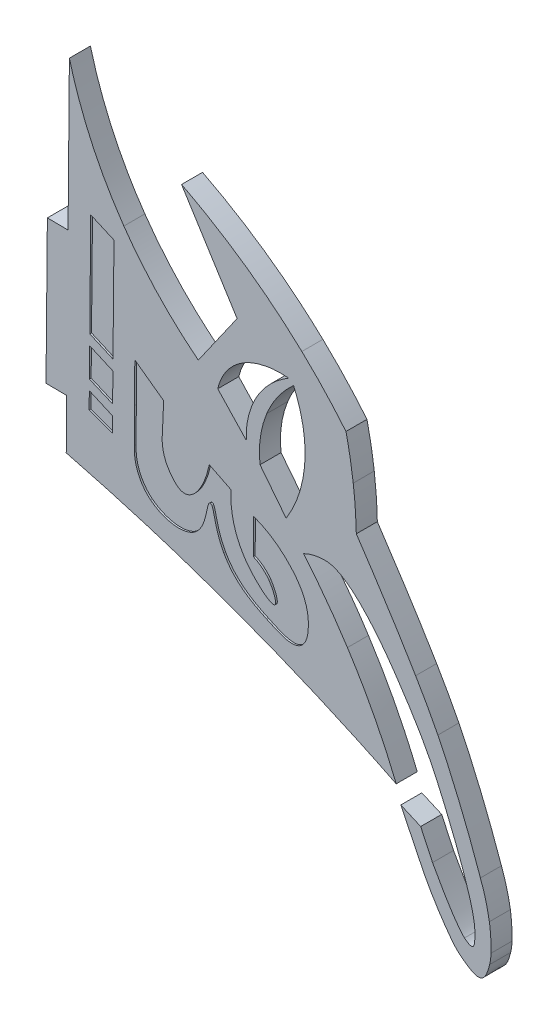
from build123d import *

# Parameters (mm, degrees)
BOSS_EXTRUDE1_DEPTH = 5.5
BOSS_EXTRUDE2_DEPTH = 6


with BuildPart() as part:
    # Model → Boss-Extrude1 (new body)
    with BuildSketch(Plane.XY):
        with BuildLine():
            add(Edge.make_bspline(
                [(88.787919, 92.364853), (92.085001, 87.464066), (99.347181, 76.543381), (105.730028, 65.744779)],
                knots=[0, 0, 0, 0, 1, 1, 1, 1], degree=3))
            add(Edge.make_bspline(
                [(87.907929, 104.458855), (88.450468, 100.119074), (88.710769, 96.06747), (88.787919, 92.364853)],
                knots=[0, 0, 0, 0, 1, 1, 1, 1], degree=3))
            add(Edge.make_bspline(
                [(85.832054, 116.197901), (86.649316, 112.63593), (87.376383, 108.710682), (87.907929, 104.458855)],
                knots=[0, 0, 0, 0, 1, 1, 1, 1], degree=3))
            add(Edge.make_bspline(
                [(73.238416, 129.684142), (78.121708, 125.092275), (82.287408, 120.530069), (85.832054, 116.197901)],
                knots=[0, 0, 0, 0, 1, 1, 1, 1], degree=3))
            add(Edge.make_bspline(
                [(38.881508, 153.813175), (49.049944, 148.582449), (61.31426, 140.896641), (73.238416, 129.684142)],
                knots=[0, 0, 0, 0, 1, 1, 1, 1], degree=3))
            add(Edge.make_bspline(
                [(54.743478, 128.576658), (49.456148, 136.988827), (44.168838, 145.400996), (38.881508, 153.813175)],
                knots=[0, 0, 0, 0, 1, 1, 1, 1], degree=3))
            add(Edge.make_bspline(
                [(43.662842, 112.749937), (47.356387, 118.025508), (51.049932, 123.301088), (54.743478, 128.576658)],
                knots=[0, 0, 0, 0, 1, 1, 1, 1], degree=3))
            add(Edge.make_bspline(
                [(22.409038, 135.290535), (29.67791, 124.862638), (37.578419, 117.550945), (43.662842, 112.749937)],
                knots=[0, 0, 0, 0, 1, 1, 1, 1], degree=3))
            add(Edge.make_bspline(
                [(6.847505, 169.039429), (9.040058, 160.67416), (13.381263, 148.241753), (22.409038, 135.290535)],
                knots=[0, 0, 0, 0, 1, 1, 1, 1], degree=3))
            add(Edge.make_bspline(
                [(6.472414, 126.333285), (6.597437, 140.568663), (6.722481, 154.804041), (6.847505, 169.039429)],
                knots=[0, 0, 0, 0, 1, 1, 1, 1], degree=3))
            add(Edge.make_bspline(
                [(0.560232, 126.38901), (2.530956, 126.370435), (4.50169, 126.35186), (6.472414, 126.333285)],
                knots=[0, 0, 0, 0, 1, 1, 1, 1], degree=3))
            add(Edge.make_bspline(
                [(0.173439, 85.282952), (0.302363, 98.984971), (0.431298, 112.686991), (0.560232, 126.38901)],
                knots=[0, 0, 0, 0, 1, 1, 1, 1], degree=3))
            add(Edge.make_bspline(
                [(6.08562, 85.227217), (4.114897, 85.245792), (2.144163, 85.264377), (0.173439, 85.282952)],
                knots=[0, 0, 0, 0, 1, 1, 1, 1], degree=3))
            add(Edge.make_bspline(
                [(5.9514, 70.962498), (5.996143, 75.717397), (6.040877, 80.472318), (6.08562, 85.227217)],
                knots=[0, 0, 0, 0, 1, 1, 1, 1], degree=3))
            add(Edge.make_bspline(
                [(42.967903, 60.018851), (30.04711, 64.421466), (17.657862, 68.016476), (5.9514, 70.962498)],
                knots=[0, 0, 0, 0, 1, 1, 1, 1], degree=3))
            add(Edge.make_bspline(
                [(100.185148, 36.223682), (83.509806, 44.479115), (64.411398, 52.712224), (42.967903, 60.018851)],
                knots=[0, 0, 0, 0, 1, 1, 1, 1], degree=3))
            add(Edge.make_bspline(
                [(86.258715, 62.967924), (92.48947, 53.320118), (96.953071, 44.179627), (100.185148, 36.223682)],
                knots=[0, 0, 0, 0, 1, 1, 1, 1], degree=3))
            add(Edge.make_bspline(
                [(73.697821, 79.933072), (77.813614, 75.051652), (82.100468, 69.406599), (86.258715, 62.967924)],
                knots=[0, 0, 0, 0, 1, 1, 1, 1], degree=3))
            add(Edge.make_bspline(
                [(80.203793, 81.336684), (77.512305, 81.454112), (75.242726, 80.660449), (73.697821, 79.933072)],
                knots=[0, 0, 0, 0, 1, 1, 1, 1], degree=3))
            add(Edge.make_bspline(
                [(99.746272, 63.512213), (87.992335, 80.587968), (82.025433, 81.257217), (80.203793, 81.336684)],
                knots=[0, 0, 0, 0, 1, 1, 1, 1], degree=3))
            add(Edge.make_bspline(
                [(109.917838, 46.825246), (107.601257, 51.377877), (104.564845, 56.511948), (99.746272, 63.512213)],
                knots=[0, 0, 0, 0, 1, 1, 1, 1], degree=3))
            add(Edge.make_bspline(
                [(114.062823, 37.740921), (112.488819, 41.413806), (110.950371, 44.796079), (109.917838, 46.825246)],
                knots=[0, 0, 0, 0, 1, 1, 1, 1], degree=3))
            add(Edge.make_bspline(
                [(117.05444, 30.38759), (115.694413, 33.903154), (114.559069, 36.582932), (114.062823, 37.740921)],
                knots=[0, 0, 0, 0, 1, 1, 1, 1], degree=3))
            add(Edge.make_bspline(
                [(119.666418, 23.293093), (118.682468, 26.185086), (117.846872, 28.339191), (117.05444, 30.38759)],
                knots=[0, 0, 0, 0, 1, 1, 1, 1], degree=3))
            add(Edge.make_bspline(
                [(121.247033, 18.357223), (120.767612, 20.046967), (120.289001, 21.463236), (119.666418, 23.293093)],
                knots=[0, 0, 0, 0, 1, 1, 1, 1], degree=3))
            add(Edge.make_bspline(
                [(121.967223, 15.625716), (121.680223, 16.800831), (121.422744, 17.737894), (121.247033, 18.357223)],
                knots=[0, 0, 0, 0, 1, 1, 1, 1], degree=3))
            add(Edge.make_bspline(
                [(122.536624, 7.982564), (123.008542, 11.10405), (122.224856, 14.570844), (121.967223, 15.625716)],
                knots=[0, 0, 0, 0, 1, 1, 1, 1], degree=3))
            add(Edge.make_bspline(
                [(121.93802, 6.872522), (122.374484, 7.058271), (122.485147, 7.642011), (122.536624, 7.982564)],
                knots=[0, 0, 0, 0, 1, 1, 1, 1], degree=3))
            add(Edge.make_bspline(
                [(119.69481, 7.870303), (120.141857, 7.494409), (121.236522, 6.574), (121.93802, 6.872522)],
                knots=[0, 0, 0, 0, 1, 1, 1, 1], degree=3))
            add(Edge.make_bspline(
                [(110.551763, 21.934408), (112.124156, 19.051097), (117.115032, 10.039459), (119.69481, 7.870303)],
                knots=[0, 0, 0, 0, 1, 1, 1, 1], degree=3))
            add(Edge.make_bspline(
                [(107.174688, 29.168822), (108.692678, 25.986783), (109.856958, 23.457185), (110.551763, 21.934408)],
                knots=[0, 0, 0, 0, 1, 1, 1, 1], degree=3))
            add(Edge.make_bspline(
                [(101.500431, 31.66388), (103.39185, 30.832204), (105.283269, 30.000518), (107.174688, 29.168822)],
                knots=[0, 0, 0, 0, 1, 1, 1, 1], degree=3))
            add(Edge.make_bspline(
                [(108.130123, 18.050738), (105.148802, 24.10867), (102.841551, 28.879433), (101.500431, 31.66388)],
                knots=[0, 0, 0, 0, 1, 1, 1, 1], degree=3))
            add(Edge.make_bspline(
                [(116.290954, 5.216691), (111.138974, 11.97007), (108.130123, 18.050728), (108.130123, 18.050738)],
                knots=[0, 0, 0, 0, 1, 1, 1, 1], degree=3))
            add(Edge.make_bspline(
                [(119.453744, 2.237291), (117.556649, 3.580894), (116.468092, 4.984465), (116.290954, 5.216691)],
                knots=[0, 0, 0, 0, 1, 1, 1, 1], degree=3))
            add(Edge.make_bspline(
                [(124.393954, 0.318217), (122.928026, -0.280112), (121.075008, 1.089011), (119.453744, 2.237291)],
                knots=[0, 0, 0, 0, 1, 1, 1, 1], degree=3))
            add(Edge.make_bspline(
                [(126.865481, 4.866502), (126.494598, 3.418899), (125.862458, 0.917605), (124.393954, 0.318217)],
                knots=[0, 0, 0, 0, 1, 1, 1, 1], degree=3))
            add(Edge.make_bspline(
                [(127.247532, 7.860163), (127.219068, 6.935233), (127.157397, 6.005896), (126.865481, 4.866502)],
                knots=[0, 0, 0, 0, 1, 1, 1, 1], degree=3))
            add(Edge.make_bspline(
                [(126.788773, 15.43331), (126.871065, 14.927783), (127.368131, 11.779257), (127.247532, 7.860163)],
                knots=[0, 0, 0, 0, 1, 1, 1, 1], degree=3))
            add(Edge.make_bspline(
                [(124.228518, 24.979427), (125.666578, 21.14242), (126.394702, 17.854079), (126.788773, 15.43331)],
                knots=[0, 0, 0, 0, 1, 1, 1, 1], degree=3))
            add(Edge.make_bspline(
                [(112.081425, 54.240096), (112.081435, 54.240086), (118.185627, 42.334359), (124.228518, 24.979427)],
                knots=[0, 0, 0, 0, 1, 1, 1, 1], degree=3))
            add(Edge.make_bspline(
                [(105.730028, 65.744779), (107.901662, 62.070774), (109.737775, 58.811189), (112.081425, 54.240096)],
                knots=[0, 0, 0, 0, 1, 1, 1, 1], degree=3))
        make_face()
        with BuildLine():
            add(Edge.make_bspline(
                [(61.159418, 113.371835), (57.404808, 107.667317), (57.26954, 102.09304), (57.354573, 99.787994)],
                knots=[0, 0, 0, 0, 1, 1, 1, 1], degree=3))
            add(Edge.make_bspline(
                [(57.354573, 99.787994), (54.643305, 102.676544), (51.932037, 105.565115), (49.220769, 108.453666)],
                knots=[0, 0, 0, 0, 1, 1, 1, 1], degree=3))
            add(Edge.make_bspline(
                [(49.220769, 108.453666), (49.623749, 110.18095), (50.670324, 113.422484), (53.634124, 116.295552)],
                knots=[0, 0, 0, 0, 1, 1, 1, 1], degree=3))
            add(Edge.make_bspline(
                [(53.634124, 116.295552), (59.663014, 122.139894), (68.335467, 121.331858), (69.48163, 121.207547)],
                knots=[0, 0, 0, 0, 1, 1, 1, 1], degree=3))
            add(Edge.make_bspline(
                [(69.48163, 121.207547), (67.432628, 119.999484), (63.920541, 117.566921), (61.159418, 113.371835)],
                knots=[0, 0, 0, 0, 1, 1, 1, 1], degree=3))
        make_face(mode=Mode.SUBTRACT)
        with BuildLine():
            add(Edge.make_bspline(
                [(70.862413, 120.090232), (68.837163, 118.267813), (65.425793, 114.71964), (63.208102, 109.303423)],
                knots=[0, 0, 0, 0, 1, 1, 1, 1], degree=3))
            add(Edge.make_bspline(
                [(73.539817, 98.347068), (75.463057, 108.324012), (72.500397, 116.427528), (70.862413, 120.090232)],
                knots=[0, 0, 0, 0, 1, 1, 1, 1], degree=3))
            add(Edge.make_bspline(
                [(68.754543, 86.183523), (70.48455, 88.985826), (72.528676, 93.101692), (73.539817, 98.347068)],
                knots=[0, 0, 0, 0, 1, 1, 1, 1], degree=3))
            add(Edge.make_bspline(
                [(61.291288, 95.701778), (63.779043, 92.529026), (66.266798, 89.356275), (68.754543, 86.183523)],
                knots=[0, 0, 0, 0, 1, 1, 1, 1], degree=3))
            add(Edge.make_bspline(
                [(63.208102, 109.303423), (60.817338, 103.464505), (60.998714, 98.348342), (61.291288, 95.701778)],
                knots=[0, 0, 0, 0, 1, 1, 1, 1], degree=3))
        make_face(mode=Mode.SUBTRACT)
    extrude(amount=BOSS_EXTRUDE1_DEPTH)

    # Model<3> → Boss-Extrude2 (add)
    with BuildSketch(Plane.XY):
        with BuildLine():
            add(Edge.make_bspline(
                [(88.787919, 92.364853), (92.085001, 87.464066), (99.347181, 76.543381), (105.730028, 65.744779)],
                knots=[0, 0, 0, 0, 1, 1, 1, 1], degree=3))
            add(Edge.make_bspline(
                [(105.730028, 65.744779), (107.901662, 62.070774), (109.737775, 58.811189), (112.081425, 54.240096)],
                knots=[0, 0, 0, 0, 1, 1, 1, 1], degree=3))
            add(Edge.make_bspline(
                [(112.081425, 54.240096), (112.081435, 54.240086), (118.185627, 42.334359), (124.228518, 24.979427)],
                knots=[0, 0, 0, 0, 1, 1, 1, 1], degree=3))
            add(Edge.make_bspline(
                [(124.228518, 24.979427), (125.666578, 21.14242), (126.394702, 17.854079), (126.788773, 15.43331)],
                knots=[0, 0, 0, 0, 1, 1, 1, 1], degree=3))
            add(Edge.make_bspline(
                [(126.788773, 15.43331), (126.871065, 14.927783), (127.368131, 11.779257), (127.247532, 7.860163)],
                knots=[0, 0, 0, 0, 1, 1, 1, 1], degree=3))
            add(Edge.make_bspline(
                [(127.247532, 7.860163), (127.219068, 6.935233), (127.157397, 6.005896), (126.865481, 4.866502)],
                knots=[0, 0, 0, 0, 1, 1, 1, 1], degree=3))
            add(Edge.make_bspline(
                [(126.865481, 4.866502), (126.494598, 3.418899), (125.862458, 0.917605), (124.393954, 0.318217)],
                knots=[0, 0, 0, 0, 1, 1, 1, 1], degree=3))
            add(Edge.make_bspline(
                [(124.393954, 0.318217), (122.928026, -0.280112), (121.075008, 1.089011), (119.453744, 2.237291)],
                knots=[0, 0, 0, 0, 1, 1, 1, 1], degree=3))
            add(Edge.make_bspline(
                [(119.453744, 2.237291), (117.556649, 3.580894), (116.468092, 4.984465), (116.290954, 5.216691)],
                knots=[0, 0, 0, 0, 1, 1, 1, 1], degree=3))
            add(Edge.make_bspline(
                [(116.290954, 5.216691), (111.138974, 11.97007), (108.130123, 18.050728), (108.130123, 18.050738)],
                knots=[0, 0, 0, 0, 1, 1, 1, 1], degree=3))
            add(Edge.make_bspline(
                [(108.130123, 18.050738), (105.148802, 24.10867), (102.841551, 28.879433), (101.500431, 31.66388)],
                knots=[0, 0, 0, 0, 1, 1, 1, 1], degree=3))
            add(Edge.make_bspline(
                [(101.500431, 31.66388), (103.39185, 30.832204), (105.283269, 30.000518), (107.174688, 29.168822)],
                knots=[0, 0, 0, 0, 1, 1, 1, 1], degree=3))
            add(Edge.make_bspline(
                [(107.174688, 29.168822), (108.692678, 25.986783), (109.856958, 23.457185), (110.551763, 21.934408)],
                knots=[0, 0, 0, 0, 1, 1, 1, 1], degree=3))
            add(Edge.make_bspline(
                [(110.551763, 21.934408), (112.124156, 19.051097), (117.115032, 10.039459), (119.69481, 7.870303)],
                knots=[0, 0, 0, 0, 1, 1, 1, 1], degree=3))
            add(Edge.make_bspline(
                [(119.69481, 7.870303), (120.141857, 7.494409), (121.236522, 6.574), (121.93802, 6.872522)],
                knots=[0, 0, 0, 0, 1, 1, 1, 1], degree=3))
            add(Edge.make_bspline(
                [(121.93802, 6.872522), (122.374484, 7.058271), (122.485147, 7.642011), (122.536624, 7.982564)],
                knots=[0, 0, 0, 0, 1, 1, 1, 1], degree=3))
            add(Edge.make_bspline(
                [(122.536624, 7.982564), (123.008542, 11.10405), (122.224856, 14.570844), (121.967223, 15.625716)],
                knots=[0, 0, 0, 0, 1, 1, 1, 1], degree=3))
            add(Edge.make_bspline(
                [(121.967223, 15.625716), (121.680223, 16.800831), (121.422744, 17.737894), (121.247033, 18.357223)],
                knots=[0, 0, 0, 0, 1, 1, 1, 1], degree=3))
            add(Edge.make_bspline(
                [(121.247033, 18.357223), (120.767612, 20.046967), (120.289001, 21.463236), (119.666418, 23.293093)],
                knots=[0, 0, 0, 0, 1, 1, 1, 1], degree=3))
            add(Edge.make_bspline(
                [(119.666418, 23.293093), (118.682468, 26.185086), (117.846872, 28.339191), (117.05444, 30.38759)],
                knots=[0, 0, 0, 0, 1, 1, 1, 1], degree=3))
            add(Edge.make_bspline(
                [(117.05444, 30.38759), (115.694413, 33.903154), (114.559069, 36.582932), (114.062823, 37.740921)],
                knots=[0, 0, 0, 0, 1, 1, 1, 1], degree=3))
            add(Edge.make_bspline(
                [(114.062823, 37.740921), (112.488819, 41.413806), (110.950371, 44.796079), (109.917838, 46.825246)],
                knots=[0, 0, 0, 0, 1, 1, 1, 1], degree=3))
            add(Edge.make_bspline(
                [(109.917838, 46.825246), (107.601257, 51.377877), (104.564845, 56.511948), (99.746272, 63.512213)],
                knots=[0, 0, 0, 0, 1, 1, 1, 1], degree=3))
            add(Edge.make_bspline(
                [(99.746272, 63.512213), (87.992335, 80.587968), (82.025433, 81.257217), (80.203793, 81.336684)],
                knots=[0, 0, 0, 0, 1, 1, 1, 1], degree=3))
            add(Edge.make_bspline(
                [(80.203793, 81.336684), (77.512305, 81.454112), (75.242726, 80.660449), (73.697821, 79.933072)],
                knots=[0, 0, 0, 0, 1, 1, 1, 1], degree=3))
            add(Edge.make_bspline(
                [(73.697821, 79.933072), (77.813614, 75.051652), (82.100468, 69.406599), (86.258715, 62.967924)],
                knots=[0, 0, 0, 0, 1, 1, 1, 1], degree=3))
            add(Edge.make_bspline(
                [(86.258715, 62.967924), (92.48947, 53.320118), (96.953071, 44.179627), (100.185148, 36.223682)],
                knots=[0, 0, 0, 0, 1, 1, 1, 1], degree=3))
            add(Edge.make_bspline(
                [(100.185148, 36.223682), (83.509806, 44.479115), (64.411398, 52.712224), (42.967903, 60.018851)],
                knots=[0, 0, 0, 0, 1, 1, 1, 1], degree=3))
            add(Edge.make_bspline(
                [(42.967903, 60.018851), (30.04711, 64.421466), (17.657862, 68.016476), (5.9514, 70.962498)],
                knots=[0, 0, 0, 0, 1, 1, 1, 1], degree=3))
            add(Edge.make_bspline(
                [(5.9514, 70.962498), (5.996143, 75.717397), (6.040877, 80.472318), (6.08562, 85.227217)],
                knots=[0, 0, 0, 0, 1, 1, 1, 1], degree=3))
            add(Edge.make_bspline(
                [(6.08562, 85.227217), (4.114897, 85.245792), (2.144163, 85.264377), (0.173439, 85.282952)],
                knots=[0, 0, 0, 0, 1, 1, 1, 1], degree=3))
            add(Edge.make_bspline(
                [(0.173439, 85.282952), (0.302363, 98.984971), (0.431298, 112.686991), (0.560232, 126.38901)],
                knots=[0, 0, 0, 0, 1, 1, 1, 1], degree=3))
            add(Edge.make_bspline(
                [(0.560232, 126.38901), (2.530956, 126.370435), (4.50169, 126.35186), (6.472414, 126.333285)],
                knots=[0, 0, 0, 0, 1, 1, 1, 1], degree=3))
            add(Edge.make_bspline(
                [(6.472414, 126.333285), (6.597437, 140.568663), (6.722481, 154.804041), (6.847505, 169.039429)],
                knots=[0, 0, 0, 0, 1, 1, 1, 1], degree=3))
            add(Edge.make_bspline(
                [(6.847505, 169.039429), (9.040058, 160.67416), (13.381263, 148.241753), (22.409038, 135.290535)],
                knots=[0, 0, 0, 0, 1, 1, 1, 1], degree=3))
            add(Edge.make_bspline(
                [(22.409038, 135.290535), (29.67791, 124.862638), (37.578419, 117.550945), (43.662842, 112.749937)],
                knots=[0, 0, 0, 0, 1, 1, 1, 1], degree=3))
            add(Edge.make_bspline(
                [(43.662842, 112.749937), (47.356387, 118.025508), (51.049932, 123.301088), (54.743478, 128.576658)],
                knots=[0, 0, 0, 0, 1, 1, 1, 1], degree=3))
            add(Edge.make_bspline(
                [(54.743478, 128.576658), (49.456148, 136.988827), (44.168838, 145.400996), (38.881508, 153.813175)],
                knots=[0, 0, 0, 0, 1, 1, 1, 1], degree=3))
            add(Edge.make_bspline(
                [(38.881508, 153.813175), (49.049944, 148.582449), (61.31426, 140.896641), (73.238416, 129.684142)],
                knots=[0, 0, 0, 0, 1, 1, 1, 1], degree=3))
            add(Edge.make_bspline(
                [(73.238416, 129.684142), (78.121708, 125.092275), (82.287408, 120.530069), (85.832054, 116.197901)],
                knots=[0, 0, 0, 0, 1, 1, 1, 1], degree=3))
            add(Edge.make_bspline(
                [(85.832054, 116.197901), (86.649316, 112.63593), (87.376383, 108.710682), (87.907929, 104.458855)],
                knots=[0, 0, 0, 0, 1, 1, 1, 1], degree=3))
            add(Edge.make_bspline(
                [(87.907929, 104.458855), (88.450468, 100.119074), (88.710769, 96.06747), (88.787919, 92.364853)],
                knots=[0, 0, 0, 0, 1, 1, 1, 1], degree=3))
        make_face()
        with BuildLine():
            add(Edge.make_bspline(
                [(57.354573, 99.787994), (54.643305, 102.676544), (51.932037, 105.565115), (49.220769, 108.453666)],
                knots=[0, 0, 0, 0, 1, 1, 1, 1], degree=3))
            add(Edge.make_bspline(
                [(49.220769, 108.453666), (49.623749, 110.18095), (50.670324, 113.422484), (53.634124, 116.295552)],
                knots=[0, 0, 0, 0, 1, 1, 1, 1], degree=3))
            add(Edge.make_bspline(
                [(53.634124, 116.295552), (59.663014, 122.139894), (68.335467, 121.331858), (69.48163, 121.207547)],
                knots=[0, 0, 0, 0, 1, 1, 1, 1], degree=3))
            add(Edge.make_bspline(
                [(69.48163, 121.207547), (67.432628, 119.999484), (63.920541, 117.566921), (61.159418, 113.371835)],
                knots=[0, 0, 0, 0, 1, 1, 1, 1], degree=3))
            add(Edge.make_bspline(
                [(61.159418, 113.371835), (57.404808, 107.667317), (57.26954, 102.09304), (57.354573, 99.787994)],
                knots=[0, 0, 0, 0, 1, 1, 1, 1], degree=3))
        make_face(mode=Mode.SUBTRACT)
        with BuildLine():
            add(Edge.make_bspline(
                [(70.862413, 120.090232), (68.837163, 118.267813), (65.425793, 114.71964), (63.208102, 109.303423)],
                knots=[0, 0, 0, 0, 1, 1, 1, 1], degree=3))
            add(Edge.make_bspline(
                [(63.208102, 109.303423), (60.817338, 103.464505), (60.998714, 98.348342), (61.291288, 95.701778)],
                knots=[0, 0, 0, 0, 1, 1, 1, 1], degree=3))
            add(Edge.make_bspline(
                [(61.291288, 95.701778), (63.779043, 92.529026), (66.266798, 89.356275), (68.754543, 86.183523)],
                knots=[0, 0, 0, 0, 1, 1, 1, 1], degree=3))
            add(Edge.make_bspline(
                [(68.754543, 86.183523), (70.48455, 88.985826), (72.528676, 93.101692), (73.539817, 98.347068)],
                knots=[0, 0, 0, 0, 1, 1, 1, 1], degree=3))
            add(Edge.make_bspline(
                [(73.539817, 98.347068), (75.463057, 108.324012), (72.500397, 116.427528), (70.862413, 120.090232)],
                knots=[0, 0, 0, 0, 1, 1, 1, 1], degree=3))
        make_face(mode=Mode.SUBTRACT)
        with BuildLine():
            add(Edge.make_bspline(
                [(19.580547, 130.415371), (17.370226, 131.387139), (15.159894, 132.358897), (12.949572, 133.330654)],
                knots=[0, 0, 0, 0, 1, 1, 1, 1], degree=3))
            add(Edge.make_bspline(
                [(12.949572, 133.330654), (12.856821, 123.472916), (12.764059, 113.615177), (12.671308, 103.757439)],
                knots=[0, 0, 0, 0, 1, 1, 1, 1], degree=3))
            add(Edge.make_bspline(
                [(12.671308, 103.757439), (14.881629, 102.785671), (17.091951, 101.813924), (19.302272, 100.842156)],
                knots=[0, 0, 0, 0, 1, 1, 1, 1], degree=3))
            add(Edge.make_bspline(
                [(19.302272, 100.842156), (19.395034, 110.699905), (19.487785, 120.557633), (19.580547, 130.415371)],
                knots=[0, 0, 0, 0, 1, 1, 1, 1], degree=3))
        make_face(mode=Mode.SUBTRACT)
        with BuildLine():
            add(Edge.make_bspline(
                [(19.274445, 97.884834), (17.064123, 98.856602), (14.853802, 99.828359), (12.64348, 100.800116)],
                knots=[0, 0, 0, 0, 1, 1, 1, 1], degree=3))
            add(Edge.make_bspline(
                [(12.64348, 100.800116), (12.6175, 98.039607), (12.591531, 95.279108), (12.565551, 92.518598)],
                knots=[0, 0, 0, 0, 1, 1, 1, 1], degree=3))
            add(Edge.make_bspline(
                [(12.565551, 92.518598), (14.77616, 91.577508), (16.986779, 90.636428), (19.197388, 89.695337)],
                knots=[0, 0, 0, 0, 1, 1, 1, 1], degree=3))
            add(Edge.make_bspline(
                [(19.197388, 89.695337), (19.22307, 92.425169), (19.248762, 95.155002), (19.274445, 97.884834)],
                knots=[0, 0, 0, 0, 1, 1, 1, 1], degree=3))
        make_face(mode=Mode.SUBTRACT)
        with BuildLine():
            add(Edge.make_bspline(
                [(19.16956, 86.738015), (16.959239, 87.709772), (14.748907, 88.681529), (12.538585, 89.653287)],
                knots=[0, 0, 0, 0, 1, 1, 1, 1], degree=3))
            add(Edge.make_bspline(
                [(12.538585, 89.653287), (12.523383, 88.03703), (12.508171, 86.420763), (12.492969, 84.804506)],
                knots=[0, 0, 0, 0, 1, 1, 1, 1], degree=3))
            add(Edge.make_bspline(
                [(12.492969, 84.804506), (14.704954, 84.00996), (16.916948, 83.215423), (19.128933, 82.420877)],
                knots=[0, 0, 0, 0, 1, 1, 1, 1], degree=3))
            add(Edge.make_bspline(
                [(19.128933, 82.420877), (19.142472, 83.859923), (19.156021, 85.298969), (19.16956, 86.738015)],
                knots=[0, 0, 0, 0, 1, 1, 1, 1], degree=3))
        make_face(mode=Mode.SUBTRACT)
        with BuildLine():
            add(Edge.make_bspline(
                [(68.251512, 76.621924), (70.112178, 74.868524), (74.83607, 70.416944), (75.069889, 63.984505)],
                knots=[0, 0, 0, 0, 1, 1, 1, 1], degree=3))
            add(Edge.make_bspline(
                [(75.069889, 63.984505), (75.122342, 62.541278), (75.274823, 58.347034), (72.751296, 56.687669)],
                knots=[0, 0, 0, 0, 1, 1, 1, 1], degree=3))
            add(Edge.make_bspline(
                [(72.751296, 56.687669), (70.338473, 55.101093), (66.864017, 56.742397), (63.205874, 58.470483)],
                knots=[0, 0, 0, 0, 1, 1, 1, 1], degree=3))
            add(Edge.make_bspline(
                [(63.205874, 58.470483), (59.941341, 60.012625), (54.256963, 62.618906), (50.92769, 68.719803)],
                knots=[0, 0, 0, 0, 1, 1, 1, 1], degree=3))
            add(Edge.make_bspline(
                [(50.92769, 68.719803), (48.016159, 74.055207), (48.257758, 79.070411), (47.08775, 79.073329)],
                knots=[0, 0, 0, 0, 1, 1, 1, 1], degree=3))
            add(Edge.make_bspline(
                [(47.08775, 79.073329), (45.762613, 79.076616), (46.492102, 72.394773), (42.499146, 69.643716)],
                knots=[0, 0, 0, 0, 1, 1, 1, 1], degree=3))
            add(Edge.make_bspline(
                [(42.499146, 69.643716), (39.162647, 67.344926), (33.580886, 68.513302), (30.058575, 71.352179)],
                knots=[0, 0, 0, 0, 1, 1, 1, 1], degree=3))
            add(Edge.make_bspline(
                [(30.058575, 71.352179), (25.800843, 74.783796), (25.453558, 79.929836), (25.407665, 80.824756)],
                knots=[0, 0, 0, 0, 1, 1, 1, 1], degree=3))
            add(Edge.make_bspline(
                [(25.407665, 80.824756), (25.403765, 81.220622), (25.398427, 81.815993), (25.394465, 82.538377)],
                knots=[0, 0, 0, 0, 1, 1, 1, 1], degree=3))
            add(Edge.make_bspline(
                [(25.394465, 82.538377), (25.368095, 87.321591), (25.454154, 90.834474), (25.464008, 92.421101)],
                knots=[0, 0, 0, 0, 1, 1, 1, 1], degree=3))
            add(Edge.make_bspline(
                [(25.464008, 92.421101), (25.487524, 96.203432), (25.507489, 99.985094), (25.523892, 103.766089)],
                knots=[0, 0, 0, 0, 1, 1, 1, 1], degree=3))
            add(Edge.make_bspline(
                [(25.523892, 103.766089), (28.270676, 101.772388), (31.017439, 99.778675), (33.764233, 97.784974)],
                knots=[0, 0, 0, 0, 1, 1, 1, 1], degree=3))
            add(Edge.make_bspline(
                [(33.764233, 97.784974), (33.643993, 94.969921), (33.523742, 92.154869), (33.403512, 89.339816)],
                knots=[0, 0, 0, 0, 1, 1, 1, 1], degree=3))
            add(Edge.make_bspline(
                [(33.403512, 89.339816), (33.288086, 88.073533), (33.115475, 84.331917), (35.574674, 80.968526)],
                knots=[0, 0, 0, 0, 1, 1, 1, 1], degree=3))
            add(Edge.make_bspline(
                [(35.574674, 80.968526), (36.352551, 79.904635), (37.806141, 77.916614), (39.623182, 77.833993)],
                knots=[0, 0, 0, 0, 1, 1, 1, 1], degree=3))
            add(Edge.make_bspline(
                [(39.623182, 77.833993), (42.358572, 77.709599), (45.485549, 81.923014), (46.80114, 88.466789)],
                knots=[0, 0, 0, 0, 1, 1, 1, 1], degree=3))
            add(Edge.make_bspline(
                [(46.80114, 88.466789), (48.85395, 87.445286), (50.906791, 86.423794), (52.959602, 85.402291)],
                knots=[0, 0, 0, 0, 1, 1, 1, 1], degree=3))
            add(Edge.make_bspline(
                [(52.959602, 85.402291), (52.83893, 81.924442), (53.203141, 76.016413), (56.850855, 70.536653)],
                knots=[0, 0, 0, 0, 1, 1, 1, 1], degree=3))
            add(Edge.make_bspline(
                [(56.850855, 70.536653), (59.720004, 66.226461), (64.482019, 62.389381), (65.499709, 63.136412)],
                knots=[0, 0, 0, 0, 1, 1, 1, 1], degree=3))
            add(Edge.make_bspline(
                [(65.499709, 63.136412), (66.23043, 63.672791), (65.115882, 66.633936), (63.861848, 68.406301)],
                knots=[0, 0, 0, 0, 1, 1, 1, 1], degree=3))
            add(Edge.make_bspline(
                [(63.861848, 68.406301), (62.379805, 70.500932), (60.458546, 71.542694), (59.395958, 72.017832)],
                knots=[0, 0, 0, 0, 1, 1, 1, 1], degree=3))
            add(Edge.make_bspline(
                [(59.395958, 72.017832), (59.427296, 75.34849), (59.458634, 78.679127), (59.489983, 82.009785)],
                knots=[0, 0, 0, 0, 1, 1, 1, 1], degree=3))
            add(Edge.make_bspline(
                [(59.489983, 82.009785), (63.811089, 80.407552), (66.655223, 78.126197), (68.251512, 76.621924)],
                knots=[0, 0, 0, 0, 1, 1, 1, 1], degree=3))
        make_face(mode=Mode.SUBTRACT)
    extrude(amount=BOSS_EXTRUDE2_DEPTH)


solid = part.part
